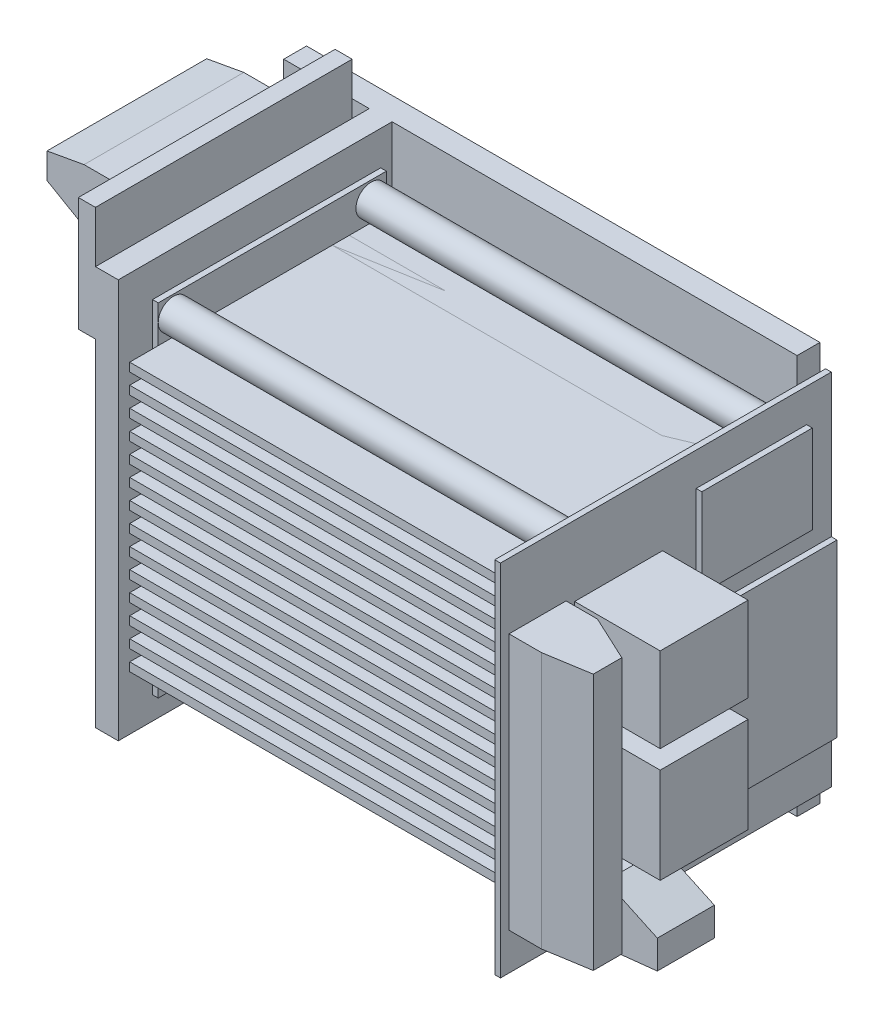
from build123d import *

# Parameters (mm, degrees)
SKETCH2_W              = 90
SKETCH2_H              = 70
BOSS_EXTRUDE1_DEPTH    = 4
SKETCH3_W              = 4
SKETCH3_H              = 70
BOSS_EXTRUDE2_DEPTH    = 52
SKETCH4_W              = 45
SKETCH4_H              = 20
BOSS_EXTRUDE3_DEPTH    = 3
BOSS_EXTRUDE4_DEPTH    = 28
SKETCH6_W              = 40
SKETCH6_H              = 60
BOSS_EXTRUDE5_DEPTH    = 1
SKETCH7_R              = 2.670201232
BOSS_EXTRUDE6_DEPTH    = 70
SKETCH8_W              = 27
SKETCH8_H              = 47
BOSS_EXTRUDE7_DEPTH    = 65
BOSS_EXTRUDE8_DEPTH    = 65
BOSS_EXTRUDE8_2_DEPTH  = 65
SKETCH11_W             = 58
SKETCH11_H             = 63
BOSS_EXTRUDE9_DEPTH    = 1
BOSS_EXTRUDE10_DEPTH   = 45
SKETCH14_W             = 15.411636089
SKETCH14_H             = 14.844874065
BOSS_EXTRUDE11_DEPTH   = 15
SKETCH14_H_2           = 16.745742084
BOSS_EXTRUDE11_2_DEPTH = 15
BOSS_EXTRUDE12_DEPTH   = 10
SKETCH16_W             = 20
SKETCH16_H             = 30
BOSS_EXTRUDE13_DEPTH   = 1
SKETCH18_W             = 19.370750303
SKETCH18_H             = 15.478496738
BOSS_EXTRUDE14_DEPTH   = 1


with BuildPart() as part:
    # Sketch2 → Boss-Extrude1 (new body)
    with BuildSketch(Plane.XY):
        with Locations((45, 35)):
            Rectangle(SKETCH2_W, SKETCH2_H)
    extrude(amount=BOSS_EXTRUDE1_DEPTH)

    # Sketch3 → Boss-Extrude2 (add)
    with BuildSketch(Plane.XY):
        with Locations((17, 35)):
            Rectangle(SKETCH3_W, SKETCH3_H)
    extrude(amount=BOSS_EXTRUDE2_DEPTH)



with BuildPart() as body_2:
    # Sketch4 → Boss-Extrude3 (new body)
    with BuildSketch(Plane(origin=(15, 0, 0), x_dir=(0, 0, -1), z_dir=(1, 0, 0))):
        with Locations((-29.5, 69)):
            Rectangle(SKETCH4_W, SKETCH4_H)
    extrude(amount=-BOSS_EXTRUDE3_DEPTH)


with BuildPart() as part_1:
    add(part.part)

    add(body_2.part)  # Boss-Extrude4 merges body 2
    # Sketch5 → Boss-Extrude4 (add)
    with BuildSketch(Plane.XY.offset(45)):
        Polygon((12, 77.489636969), (12, 67.489636969), (7, 67.489636969), (-0.5, 71.819763988), (-0.5, 76.319763988), (6, 77.489636969), align=None)
    extrude(amount=-BOSS_EXTRUDE4_DEPTH)


with BuildPart() as body_2_2:
    # Sketch6 → Boss-Extrude5 (new body)
    with BuildSketch(Plane(origin=(20, 0, 0), x_dir=(0, 0, -1), z_dir=(1, 0, 0))):
        with Locations((-27, 35)):
            Rectangle(SKETCH6_W, SKETCH6_H)
    extrude(amount=BOSS_EXTRUDE5_DEPTH)

    # Sketch7 → Boss-Extrude6 (add)
    with BuildSketch(Plane(origin=(21, 0, 0), x_dir=(0, 0, -1), z_dir=(1, 0, 0))):
        with Locations(Location((-44.329798768, 7.999901376, 0), (0, 0, 180))):
            Circle(SKETCH7_R)
        with Locations(Location((-44.329798768, 62.000098624, 0), (0, 0, 180))):
            Circle(SKETCH7_R)
        with Locations((-9.670201232, 62.000098624)):
            Circle(SKETCH7_R)
        with Locations(Location((-9.670201232, 7.999901376, 0), (0, 0, 180))):
            Circle(SKETCH7_R)
    extrude(amount=BOSS_EXTRUDE6_DEPTH)

    # Sketch8 → Boss-Extrude7 (add)
    with BuildSketch(Plane(origin=(21, 0, 0), x_dir=(0, 0, -1), z_dir=(1, 0, 0))):
        with Locations((-27, 35)):
            Rectangle(SKETCH8_W, SKETCH8_H)
    extrude(amount=BOSS_EXTRUDE7_DEPTH)

    # Sketch11 → Boss-Extrude9 (add)
    with BuildSketch(Plane(origin=(91, 0, 0), x_dir=(0, 0, -1), z_dir=(1, 0, 0))):
        with Locations((-29, 34.999901376)):
            Rectangle(SKETCH11_W, SKETCH11_H)
    extrude(amount=BOSS_EXTRUDE9_DEPTH)

    # Sketch15 → Boss-Extrude12 (add)
    with BuildSketch(Plane.XY.offset(45)):
        Polygon((92, 4.499901376), (92, 14.499901376), (97.5, 14.499901376), (106.5, 10.303132453), (106.5, 5.303132453), (99, 4.499901376), align=None)
    extrude(amount=-BOSS_EXTRUDE12_DEPTH)


with BuildPart() as body_3:
    # Sketch10 → Boss-Extrude8 (new body)
    with BuildSketch(Plane(origin=(21, 0, 0), x_dir=(0, 0, -1), z_dir=(1, 0, 0))):
        Polygon((-45, 16.5), (-52, 16.5), (-52, 15), (-45, 15), (-45, 13), (-52, 13), (-52, 11.5), (-40.5, 11.5), (-40.5, 58.5), (-52, 58.5), (-52, 57), (-45, 57), (-45, 55), (-52, 55), (-52, 53.5), (-45, 53.5), (-45, 51.5), (-52, 51.5), (-52, 50), (-45, 50), (-45, 48), (-52, 48), (-52, 46.5), (-45, 46.5), (-45, 44.5), (-52, 44.5), (-52, 43), (-45, 43), (-45, 41), (-52, 41), (-52, 39.5), (-45, 39.5), (-45, 37.5), (-52, 37.5), (-52, 36), (-45, 36), (-45, 34), (-52, 34), (-52, 32.5), (-45, 32.5), (-45, 30.5), (-52, 30.5), (-52, 29), (-45, 29), (-45, 27), (-52, 27), (-52, 25.5), (-45, 25.5), (-45, 23.5), (-52, 23.5), (-52, 22), (-45, 22), (-45, 20), (-52, 20), (-52, 18.5), (-45, 18.5), align=None)
    extrude(amount=BOSS_EXTRUDE8_DEPTH)


with BuildPart() as body_4:
    # Sketch10 → Boss-Extrude8 2 (new body)
    with BuildSketch(Plane(origin=(21, 0, 0), x_dir=(0, 0, -1), z_dir=(1, 0, 0))):
        Polygon((-16.5, 11.5), (-16.5, 58.5), (-5, 58.5), (-5, 57), (-12, 57), (-12, 55), (-5, 55), (-5, 53.5), (-12, 53.5), (-12, 51.5), (-5, 51.5), (-5, 50), (-12, 50), (-12, 48), (-5, 48), (-5, 46.5), (-12, 46.5), (-12, 44.5), (-5, 44.5), (-5, 43), (-12, 43), (-12, 41), (-5, 41), (-5, 39.5), (-12, 39.5), (-12, 37.5), (-5, 37.5), (-5, 36), (-12, 36), (-12, 34), (-5, 34), (-5, 32.5), (-12, 32.5), (-12, 30.5), (-5, 30.5), (-5, 29), (-12, 29), (-12, 27), (-5, 27), (-5, 25.5), (-12, 25.5), (-12, 23.5), (-5, 23.5), (-5, 22), (-12, 22), (-12, 20), (-5, 20), (-5, 18.5), (-12, 18.5), (-12, 16.5), (-5, 16.5), (-5, 15), (-12, 15), (-12, 13), (-5, 13), (-5, 11.5), align=None)
    extrude(amount=BOSS_EXTRUDE8_2_DEPTH)


with BuildPart() as body_5:
    # Sketch13 → Boss-Extrude10 (new body)
    with BuildSketch(Plane(origin=(0, 10, 0), x_dir=(1, 0, 0), z_dir=(0, 1, 0))):
        Polygon((92, -56.5), (92, -46.5), (97.5, -46.5), (105.5, -50.230461265), (105.5, -55.230461265), (97.682997604, -56.5), align=None)
    extrude(amount=BOSS_EXTRUDE10_DEPTH)


with BuildPart() as body_6:
    # Sketch14 → Boss-Extrude11 (new body)
    with BuildSketch(Plane(origin=(92, 0, 0), x_dir=(0, 0, -1), z_dir=(1, 0, 0))):
        with Locations((-37.294181956, 46.741401983)):
            Rectangle(SKETCH14_W, SKETCH14_H)
    extrude(amount=BOSS_EXTRUDE11_DEPTH)


with BuildPart() as body_7:
    # Sketch14 → Boss-Extrude11 2 (new body)
    with BuildSketch(Plane(origin=(92, 0, 0), x_dir=(0, 0, -1), z_dir=(1, 0, 0))):
        with Locations((-37.294181956, 27.687463016)):
            Rectangle(SKETCH14_W, SKETCH14_H_2)
    extrude(amount=BOSS_EXTRUDE11_2_DEPTH)


with BuildPart() as body_8:
    # Sketch16 → Boss-Extrude13 (new body)
    with BuildSketch(Plane(origin=(94, 0, 0), x_dir=(0, 0, -1), z_dir=(1, 0, 0))):
        with Locations((-12, 28.499901376)):
            Rectangle(SKETCH16_W, SKETCH16_H)
    extrude(amount=BOSS_EXTRUDE13_DEPTH)


with BuildPart() as body_9:
    # Sketch18 → Boss-Extrude14 (new body)
    with BuildSketch(Plane(origin=(94, 0, 0), x_dir=(0, 0, -1), z_dir=(1, 0, 0))):
        with Locations((-16.010735194, 54.933237975)):
            Rectangle(SKETCH18_W, SKETCH18_H)
    extrude(amount=BOSS_EXTRUDE14_DEPTH)


solid = Compound([part_1.part, body_2_2.part, body_3.part, body_4.part, body_5.part, body_6.part, body_7.part, body_8.part, body_9.part])
